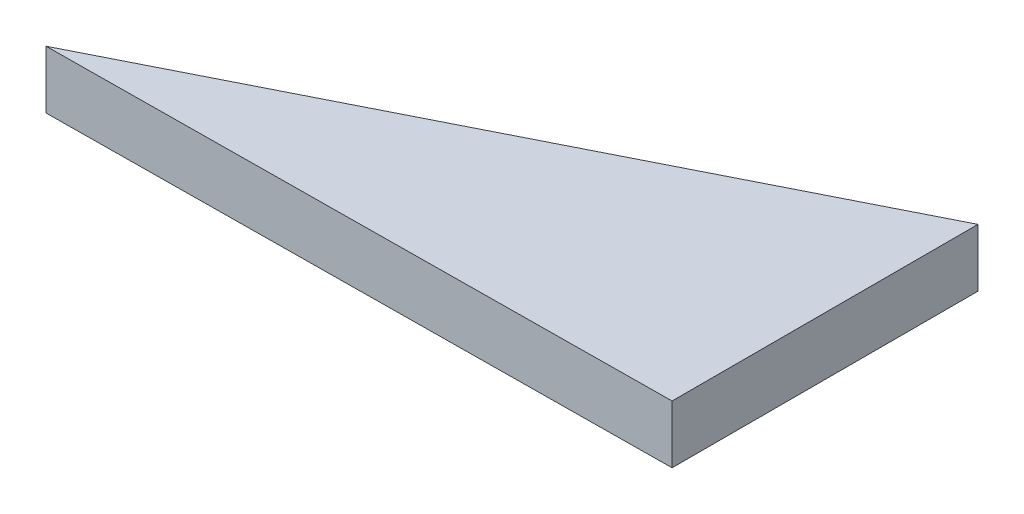
from build123d import *

# Parameters (mm, degrees)
SKETCH1_W           = 263.3434916
SKETCH1_H           = 204.19140391
BOSS_EXTRUDE1_DEPTH = 4.599999944
SKETCH3_OUTSIDE_W   = 331.995
SKETCH3_OUTSIDE_H   = 272.843
CUT_EXTRUDE2_DEPTH  = 334.264285513


with BuildPart() as part:
    # Sketch1 → Boss-Extrude1 (new body)
    with BuildSketch(Plane(origin=(0, 0, 0), x_dir=(1, 0, 0), z_dir=(0, 1, 0))):
        with Locations((131.6717458, 102.095701955)):
            Rectangle(SKETCH1_W, SKETCH1_H)
    extrude(amount=BOSS_EXTRUDE1_DEPTH)

    # Sketch3 outside → Cut-Extrude2 (cut, through all)
    with BuildSketch(Plane.XZ):
        with Locations((131.6715, -102.0955)):
            Rectangle(SKETCH3_OUTSIDE_W, SKETCH3_OUTSIDE_H)
        Polygon((263.3434916, -76.442048913), (214.045949403, -75.982429436), (263.3434916, -100.754365544), align=None, mode=Mode.SUBTRACT)
    extrude(amount=-CUT_EXTRUDE2_DEPTH, mode=Mode.SUBTRACT)


solid = part.part
